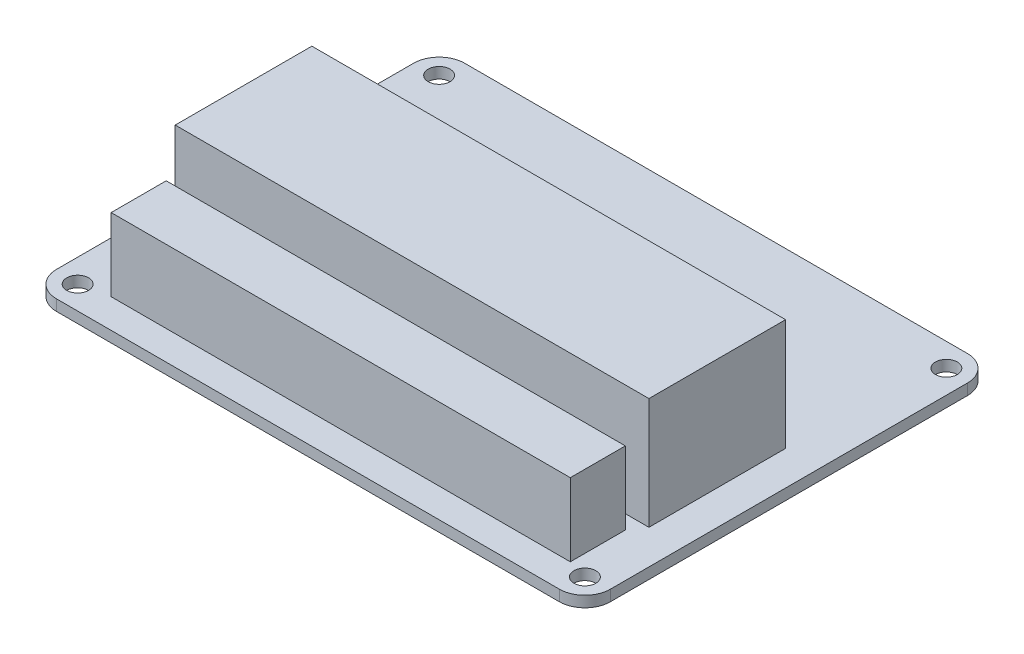
from build123d import *

# Parameters (mm, degrees)
SKETCH1_W           = 76
SKETCH1_H           = 56
SKETCH1_R           = 1.5
BOSS_EXTRUDE1_DEPTH = 1.5
FILLET1_R           = 3.5
SKETCH3_W           = 63
SKETCH3_H           = 7.55
BOSS_EXTRUDE3_DEPTH = 10
SKETCH4_W           = 65
SKETCH4_H           = 18.75
BOSS_EXTRUDE4_DEPTH = 15.3


with BuildPart() as part:
    # Sketch1 → Boss-Extrude1 (new body)
    with BuildSketch(Plane(origin=(0, 0, 0), x_dir=(1, 0, 0), z_dir=(0, 1, 0))):
        with Locations((38, -28)):
            Rectangle(SKETCH1_W, SKETCH1_H)
        with Locations(Location((72.8, -52.8, 0), (0, 0, 270))):
            Circle(SKETCH1_R, mode=Mode.SUBTRACT)
        with Locations(Location((72.8, -3.2, 0), (0, 0, 270))):
            Circle(SKETCH1_R, mode=Mode.SUBTRACT)
        with Locations(Location((3.2, -3.2, 0), (0, 0, 270))):
            Circle(SKETCH1_R, mode=Mode.SUBTRACT)
        with Locations(Location((3.2, -52.8, 0), (0, 0, 270))):
            Circle(SKETCH1_R, mode=Mode.SUBTRACT)
    extrude(amount=BOSS_EXTRUDE1_DEPTH)

    # Fillet1
    fillet1_edges = [part.edges().sort_by_distance(p)[0] for p in [
        (0, 0.75, 56),
        (0, 0.75, 0),
        (76, 0.75, 0),
        (76, 0.75, 56),
    ]]
    fillet(fillet1_edges, radius=FILLET1_R)

    # Sketch3 → Boss-Extrude3 (add)
    with BuildSketch(Plane(origin=(0, 1.5, 0), x_dir=(1, 0, 0), z_dir=(0, 1, 0))):
        with Locations((38.5, -48.225)):
            Rectangle(SKETCH3_W, SKETCH3_H)
    extrude(amount=BOSS_EXTRUDE3_DEPTH)

    # Sketch4 → Boss-Extrude4 (add)
    with BuildSketch(Plane(origin=(0, 1.5, 0), x_dir=(1, 0, 0), z_dir=(0, 1, 0))):
        with Locations((38.794123638, -33.130364422)):
            Rectangle(SKETCH4_W, SKETCH4_H)
    extrude(amount=BOSS_EXTRUDE4_DEPTH)


solid = part.part
